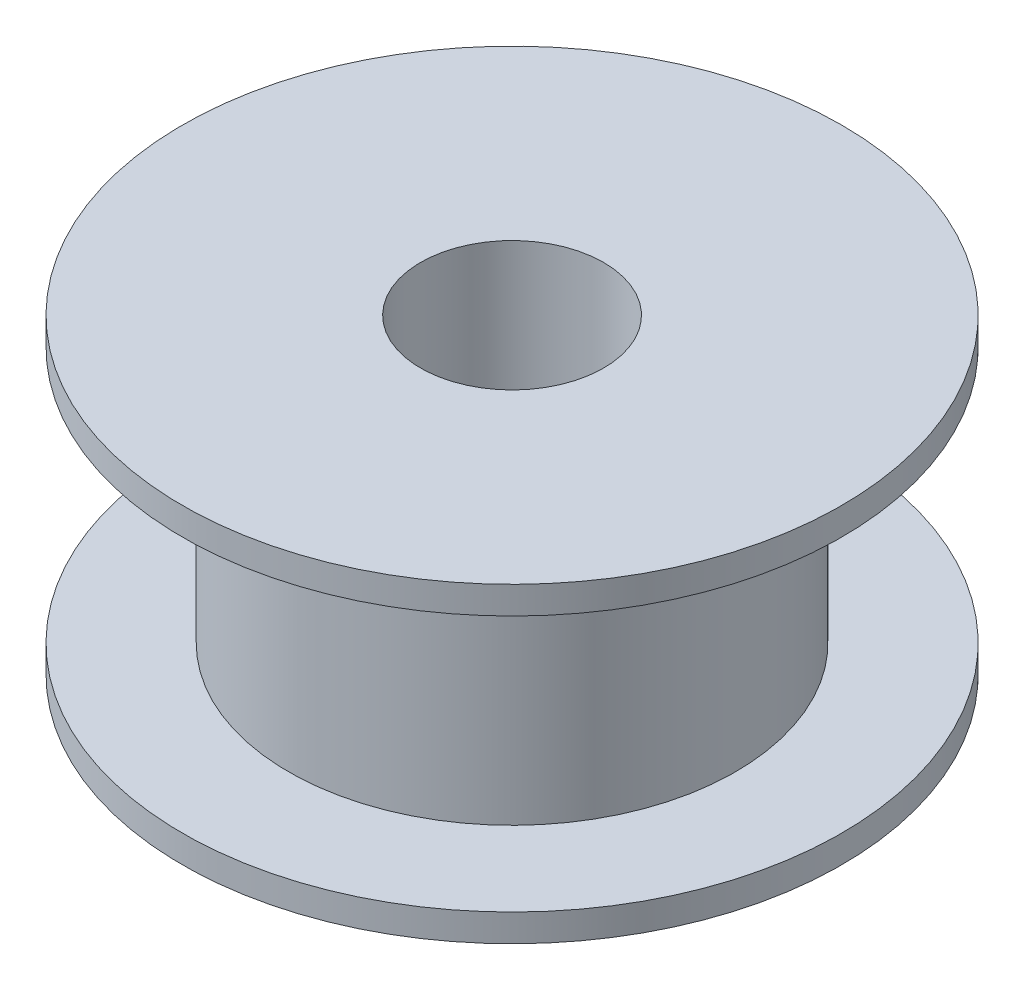
from build123d import *


with BuildPart() as part:
    # Sketch1 → Revolve1 (revolve)
    with BuildSketch(Plane.XY, mode=Mode.PRIVATE) as revolve1_sk:
        Polygon((2.5, 0), (2.5, 8.5), (9, 8.5), (9, 7.75), (6.1, 7.75), (6.1, 0.75), (9, 0.75), (9, 0), align=None)
    revolve(revolve1_sk.sketch.rotate(Axis((0, 0, 0), (0, 1, 0)), 90), axis=Axis((0, 0, 0), (0, 1, 0)))


solid = part.part
